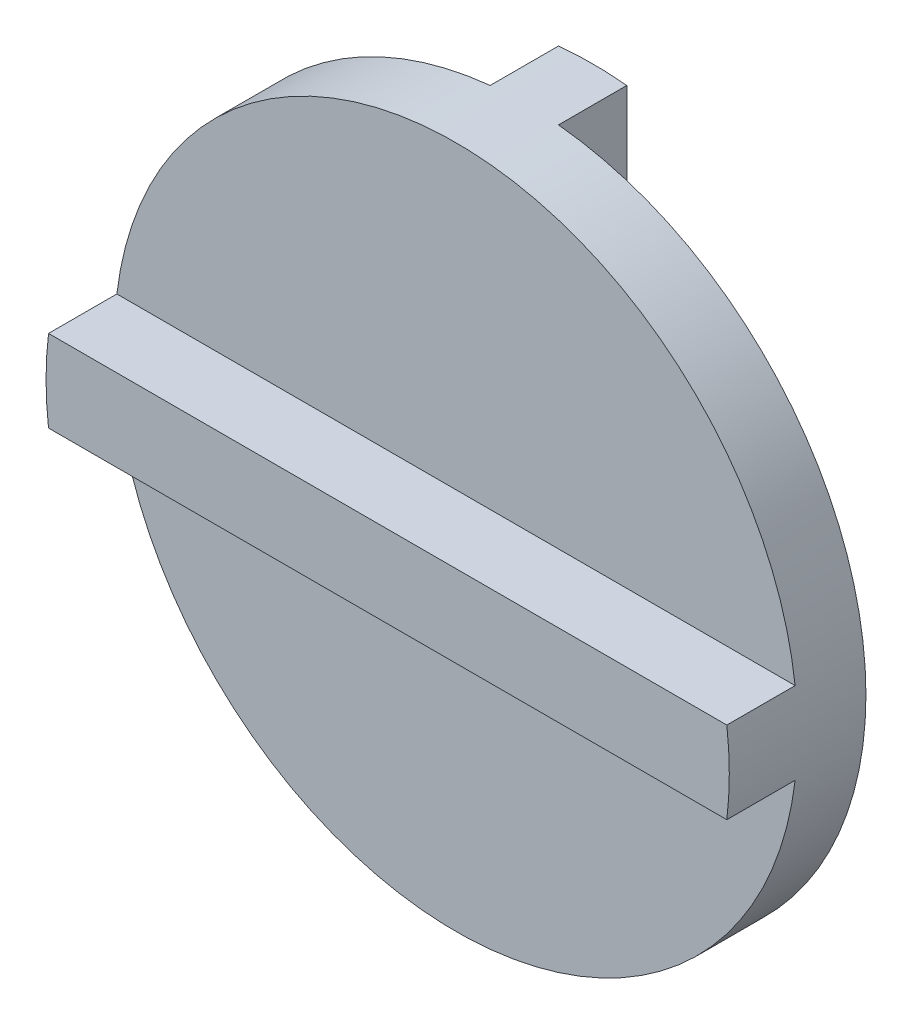
from build123d import *
from build123d.topology import SkipClean

# Parameters (mm, degrees)
SKETCH1_R           = 50
BOSS_EXTRUDE1_DEPTH = 10
BOSS_EXTRUDE2_DEPTH = 10
BOSS_EXTRUDE3_START = 10
BOSS_EXTRUDE3_DEPTH = 10


with BuildPart() as part:
    # Sketch1 → Boss-Extrude1 (new body)
    with BuildSketch(Plane.XY):
        Circle(SKETCH1_R)
    extrude(amount=BOSS_EXTRUDE1_DEPTH)

    # Sketch2 → Boss-Extrude2 (add)
    with SkipClean():  # the faces are left unmerged after this step: merging them gives an invalid solid
        with BuildSketch(Plane.XY.offset(10)):
            with BuildLine():
                Line((-49.638694584, 6), (49.638694584, 6))
                ThreePointArc((49.638694584, 6), (50, 0), (49.638694584, -6))
                Line((49.638694584, -6), (-49.638694584, -6))
                ThreePointArc((-49.638694584, -6), (-50, 0), (-49.638694584, 6))
            make_face()
        extrude(amount=BOSS_EXTRUDE2_DEPTH)

    # Sketch3 → Boss-Extrude3 (add)
    with SkipClean():  # the faces are left unmerged after this step: merging them gives an invalid solid
        with BuildSketch(Plane(origin=(0, 0, 0), x_dir=(-1, 0, 0), z_dir=(0, 0, -1)).offset(BOSS_EXTRUDE3_START)):
            with BuildLine():
                Line((-5, 49.749371855), (-5, -49.749371855))
                ThreePointArc((-5, -49.749371855), (0, -50), (5, -49.749371855))
                Line((5, -49.749371855), (5, 49.749371855))
                ThreePointArc((5, 49.749371855), (0, 50), (-5, 49.749371855))
            make_face()
        extrude(amount=-BOSS_EXTRUDE3_DEPTH)


solid = part.part
